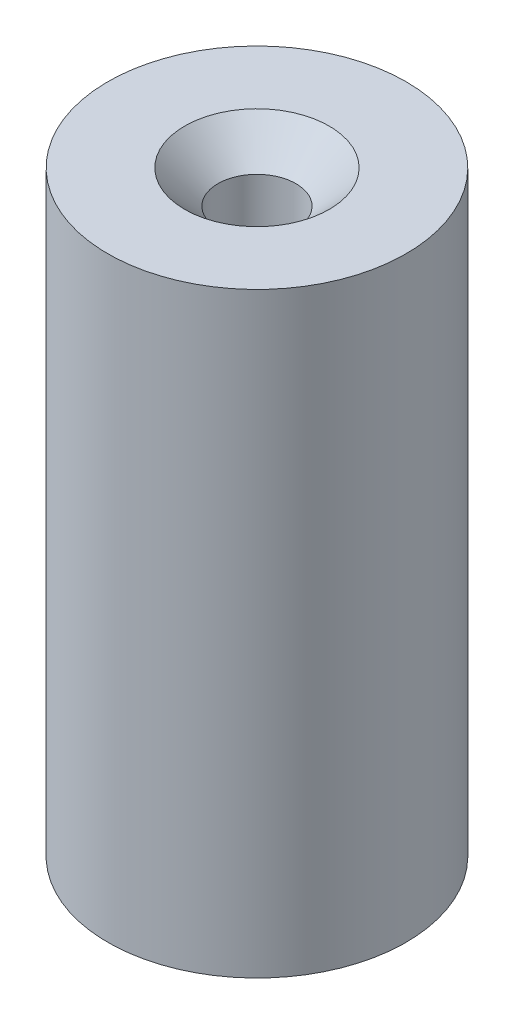
from build123d import *

# Parameters (mm, degrees)
SKETCH_1_R                  = 6.5
EXTRUDE_1_DEPTH             = 26
SKETCH_2_R                  = 2.85
CUT_EXTRUDE_1_DEPTH         = 3.5
HOLE_WIZARD_M32_D           = 3.4
HOLE_WIZARD_M32_CSINK_D     = 6.3
HOLE_WIZARD_M32_CSINK_ANGLE = 90


with BuildPart() as part:
    # Эскиз1 → Бобышка-Вытянуть1 (new body)
    with BuildSketch(Plane(origin=(0, 0, 0), x_dir=(1, 0, 0), z_dir=(0, 1, 0))):
        with Locations(Location((0, 0, 0), (0, 0, 90))):
            Circle(SKETCH_1_R)
    extrude(amount=EXTRUDE_1_DEPTH)

    # Эскиз2 → Вырез-Вытянуть1 (cut)
    with BuildSketch(Plane.XZ):
        with Locations(Location((0, 0, 0), (0, 0, 270))):
            Circle(SKETCH_2_R)
    extrude(amount=-CUT_EXTRUDE_1_DEPTH, mode=Mode.SUBTRACT)

    # Зенковка для  винта с плоской головкой M32 (through all)
    with Locations(Plane(origin=(0, 26, 0), x_dir=(1, 0, 0), z_dir=(0, 1, 0))):
        with Locations((0, 0)):
            CounterSinkHole(HOLE_WIZARD_M32_D / 2, HOLE_WIZARD_M32_CSINK_D / 2, counter_sink_angle=HOLE_WIZARD_M32_CSINK_ANGLE)


solid = part.part
